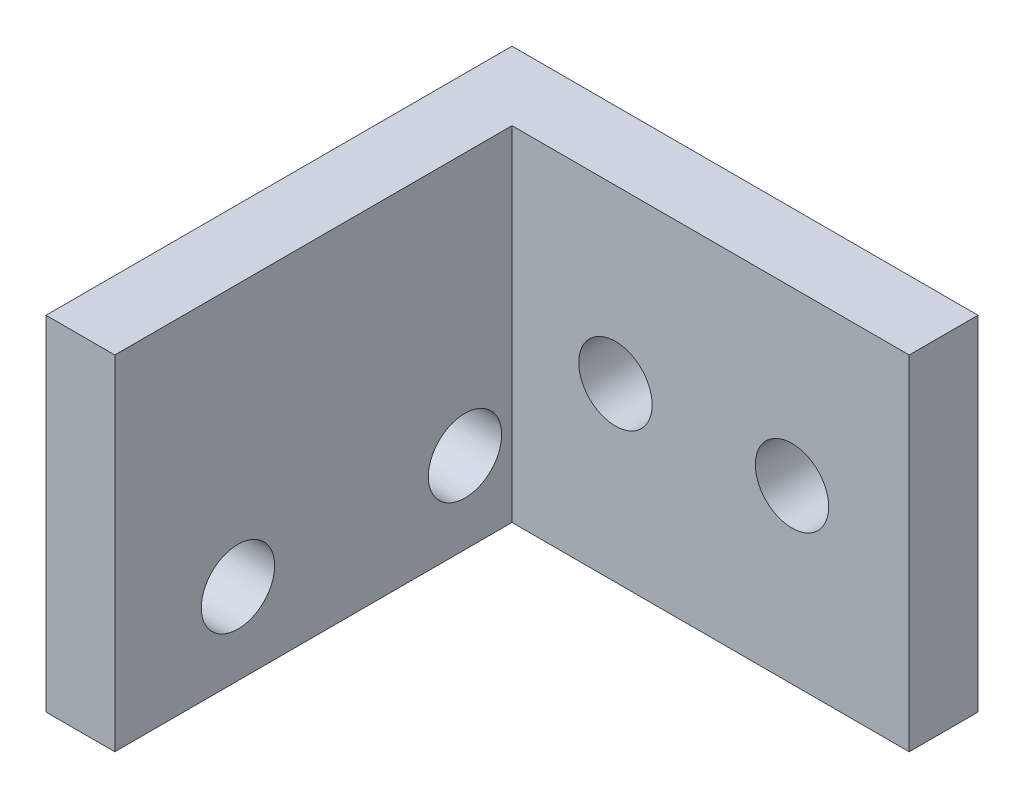
from build123d import *

# Parameters (mm, degrees)
BOSS_EXTRUDE1_DEPTH = 14.986
SKETCH2_R           = 1.6
CUT_EXTRUDE1_DEPTH  = 25
SKETCH4_R           = 1.6
CUT_EXTRUDE2_DEPTH  = 25


with BuildPart() as part:
    # Sketch1 → Boss-Extrude1 (new body)
    with BuildSketch(Plane(origin=(0, 0, 0), x_dir=(1, 0, 0), z_dir=(0, 1, 0))):
        Polygon((0, 0), (0, 20.32), (20.32, 20.32), (20.32, 17.32), (3, 17.32), (3, 0), align=None)
    extrude(amount=BOSS_EXTRUDE1_DEPTH)

    # Sketch2 → Cut-Extrude1 (cut)
    with BuildSketch(Plane.ZY):
        with Locations((-5.37, 3.55)):
            Circle(SKETCH2_R)
        with Locations((-15.27, 3.55)):
            Circle(SKETCH2_R)
    extrude(amount=-CUT_EXTRUDE1_DEPTH, mode=Mode.SUBTRACT)

    # Sketch4 → Cut-Extrude2 (cut)
    with BuildSketch(Plane.XY.offset(-17.32)):
        with Locations((7.510208413, 7.496)):
            Circle(SKETCH4_R)
        with Locations((15.208779856, 7.493)):
            Circle(SKETCH4_R)
    extrude(amount=-CUT_EXTRUDE2_DEPTH, mode=Mode.SUBTRACT)


solid = part.part
